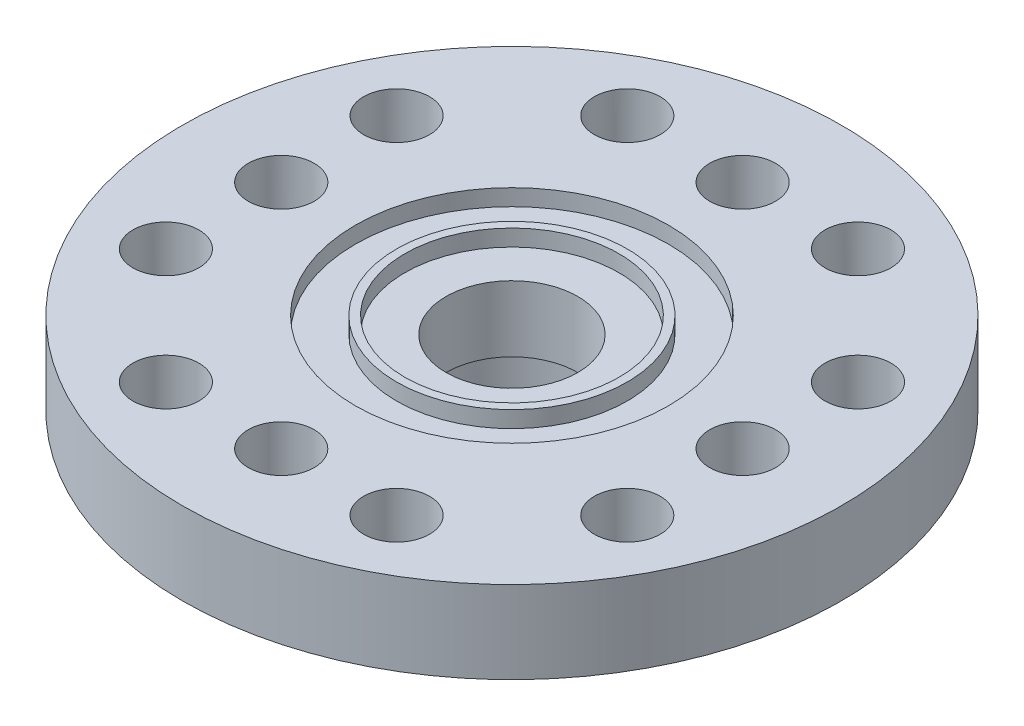
from build123d import *

# Parameters (mm, degrees)
CROQUIS1_R              = 10
SALIENTE_EXTRUIR1_DEPTH = 2.5
CROQUIS3_R              = 4.5
SALIENTE_EXTRUIR2_DEPTH = 3
CROQUIS4_R              = 2
CORTAR_EXTRUIR1_DEPTH   = 16.173990905
CROQUIS5_R              = 2.5
CORTAR_EXTRUIR2_DEPTH   = 3
CROQUIS6_R              = 4.75
CROQUIS6_R_2            = 3.5
CROQUIS6_R_3            = 3.25
CROQUIS6_R_4            = 2
CORTAR_EXTRUIR3_DEPTH   = 0.5
CROQUIS7_R              = 1
CORTAR_EXTRUIR4_DEPTH   = 16.173990905


with BuildPart() as part:
    # Croquis1 → Saliente-Extruir1 (new body)
    with BuildSketch(Plane(origin=(0, 0, 0), x_dir=(1, 0, 0), z_dir=(0, 1, 0))):
        with Locations(Location((0, 0, 0), (0, 0, 270))):
            Circle(CROQUIS1_R)
    extrude(amount=SALIENTE_EXTRUIR1_DEPTH)

    # Croquis3 → Saliente-Extruir2 (add)
    with BuildSketch(Plane.XZ):
        with Locations(Location((0, 0, 0), (0, 0, 270))):
            Circle(CROQUIS3_R)
    extrude(amount=SALIENTE_EXTRUIR2_DEPTH)

    # Croquis4 → Cortar-Extruir1 (cut, through all)
    with BuildSketch(Plane(origin=(0, 2.5, 0), x_dir=(1, 0, 0), z_dir=(0, 1, 0))):
        with Locations(Location((0, 0, 0), (0, 0, 270))):
            Circle(CROQUIS4_R)
    extrude(amount=-CORTAR_EXTRUIR1_DEPTH, mode=Mode.SUBTRACT)

    # Croquis5 → Cortar-Extruir2 (cut)
    with BuildSketch(Plane.XZ.offset(3)):
        with Locations(Location((0, 0, 0), (0, 0, 270))):
            Circle(CROQUIS5_R)
    extrude(amount=-CORTAR_EXTRUIR2_DEPTH, mode=Mode.SUBTRACT)

    # Croquis6 → Cortar-Extruir3 (cut)
    # profile 1 of 2: a face of its own
    with BuildSketch(Plane(origin=(0, 2.5, 0), x_dir=(1, 0, 0), z_dir=(0, 1, 0))):
        with Locations(Location((0, 0, 0), (0, 0, 270))):
            Circle(CROQUIS6_R)
        with Locations(Location((0, 0, 0), (0, 0, 270))):
            Circle(CROQUIS6_R_2, mode=Mode.SUBTRACT)
    # profile 2 of 2: a face of its own
    with BuildSketch(Plane(origin=(0, 2.5, 0), x_dir=(1, 0, 0), z_dir=(0, 1, 0))):
        with Locations(Location((0, 0, 0), (0, 0, 270))):
            Circle(CROQUIS6_R_3)
        with Locations(Location((0, 0, 0), (0, 0, 270))):
            Circle(CROQUIS6_R_4, mode=Mode.SUBTRACT)
    extrude(amount=-CORTAR_EXTRUIR3_DEPTH, mode=Mode.SUBTRACT)

    # Croquis7 → Cortar-Extruir4 (cut, through all)
    with BuildSketch(Plane(origin=(0, 2.5, 0), x_dir=(1, 0, 0), z_dir=(0, 1, 0))):
        with Locations(Location((0, -7, 0), (0, 0, 270))):
            Circle(CROQUIS7_R)
        with Locations(Location((3.5, -7, 0), (0, 0, 270))):
            Circle(CROQUIS7_R)
        with Locations(Location((-3.5, -7, 0), (0, 0, 270))):
            Circle(CROQUIS7_R)
        with Locations(Location((7, 3.5, 0), (0, 0, 270))):
            Circle(CROQUIS7_R)
        with Locations(Location((7, 0, 0), (0, 0, 270))):
            Circle(CROQUIS7_R)
        with Locations(Location((7, -3.5, 0), (0, 0, 270))):
            Circle(CROQUIS7_R)
        with Locations(Location((-3.5, 7, 0), (0, 0, 270))):
            Circle(CROQUIS7_R)
        with Locations(Location((0, 7, 0), (0, 0, 270))):
            Circle(CROQUIS7_R)
        with Locations(Location((3.5, 7, 0), (0, 0, 270))):
            Circle(CROQUIS7_R)
        with Locations(Location((-7, 3.5, 0), (0, 0, 270))):
            Circle(CROQUIS7_R)
        with Locations(Location((-7, 0, 0), (0, 0, 270))):
            Circle(CROQUIS7_R)
        with Locations(Location((-7, -3.5, 0), (0, 0, 270))):
            Circle(CROQUIS7_R)
    extrude(amount=-CORTAR_EXTRUIR4_DEPTH, mode=Mode.SUBTRACT)


solid = part.part
